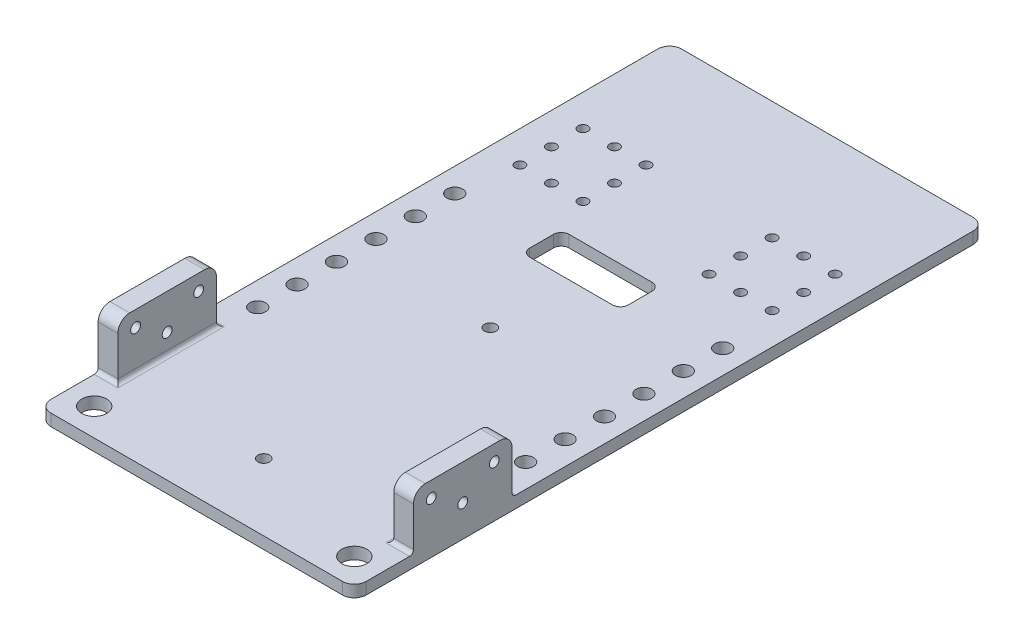
from build123d import *

# Parameters (mm, degrees)
SKETCH1_W           = 80
SKETCH1_H           = 160
SKETCH1_R           = 1.25
SKETCH1_R_2         = 1.5
SKETCH1_R_3         = 3.175
SKETCH1_W_2         = 25
SKETCH1_H_2         = 10
BOSS_EXTRUDE1_DEPTH = 3
SKETCH2_W           = 5
SKETCH2_H           = 25
BOSS_EXTRUDE2_DEPTH = 14
FILLET1_R           = 1
FILLET2_R           = 3
FILLET3_R           = 3
SKETCH4_R           = 1.25
CUT_EXTRUDE1_DEPTH  = 180.691402132
SKETCH6_R           = 2
CUT_EXTRUDE2_DEPTH  = 8.89
LPATTERN1_COUNT     = 6
LPATTERN1_PITCH     = 10
FILLET4_R           = 2


with BuildPart() as part:
    # Sketch1 → Boss-Extrude1 (new body)
    with BuildSketch(Plane(origin=(0, 0, 0), x_dir=(1, 0, 0), z_dir=(0, 1, 0))):
        with Locations((40, 80)):
            Rectangle(SKETCH1_W, SKETCH1_H)
        with Locations(Location((8, 130, 0), (0, 0, 270))):
            Circle(SKETCH1_R, mode=Mode.SUBTRACT)
        with Locations(Location((16, 130, 0), (0, 0, 270))):
            Circle(SKETCH1_R, mode=Mode.SUBTRACT)
        with Locations(Location((24, 130, 0), (0, 0, 270))):
            Circle(SKETCH1_R, mode=Mode.SUBTRACT)
        with Locations(Location((24, 122, 0), (0, 0, 270))):
            Circle(SKETCH1_R, mode=Mode.SUBTRACT)
        with Locations(Location((24, 114, 0), (0, 0, 270))):
            Circle(SKETCH1_R, mode=Mode.SUBTRACT)
        with Locations(Location((16, 114, 0), (0, 0, 270))):
            Circle(SKETCH1_R, mode=Mode.SUBTRACT)
        with Locations(Location((8, 114, 0), (0, 0, 270))):
            Circle(SKETCH1_R, mode=Mode.SUBTRACT)
        with Locations(Location((8, 122, 0), (0, 0, 270))):
            Circle(SKETCH1_R, mode=Mode.SUBTRACT)
        with Locations(Location((72, 130, 0), (0, 0, 90))):
            Circle(SKETCH1_R, mode=Mode.SUBTRACT)
        with Locations(Location((72, 122, 0), (0, 0, 90))):
            Circle(SKETCH1_R, mode=Mode.SUBTRACT)
        with Locations(Location((72, 114, 0), (0, 0, 90))):
            Circle(SKETCH1_R, mode=Mode.SUBTRACT)
        with Locations(Location((64, 114, 0), (0, 0, 90))):
            Circle(SKETCH1_R, mode=Mode.SUBTRACT)
        with Locations(Location((64, 130, 0), (0, 0, 90))):
            Circle(SKETCH1_R, mode=Mode.SUBTRACT)
        with Locations(Location((56, 130, 0), (0, 0, 90))):
            Circle(SKETCH1_R, mode=Mode.SUBTRACT)
        with Locations(Location((56, 122, 0), (0, 0, 90))):
            Circle(SKETCH1_R, mode=Mode.SUBTRACT)
        with Locations(Location((56, 114, 0), (0, 0, 90))):
            Circle(SKETCH1_R, mode=Mode.SUBTRACT)
        with Locations(Location((40, 17, 0), (0, 0, 270))):
            Circle(SKETCH1_R_2, mode=Mode.SUBTRACT)
        with Locations(Location((40, 74.5, 0), (0, 0, 270))):
            Circle(SKETCH1_R_2, mode=Mode.SUBTRACT)
        with Locations(Location((7, 7, 0), (0, 0, 270))):
            Circle(SKETCH1_R_3, mode=Mode.SUBTRACT)
        with Locations(Location((73, 7, 0), (0, 0, 90))):
            Circle(SKETCH1_R_3, mode=Mode.SUBTRACT)
        with Locations((40, 100)):
            Rectangle(SKETCH1_W_2, SKETCH1_H_2, mode=Mode.SUBTRACT)
    extrude(amount=BOSS_EXTRUDE1_DEPTH)

    # Sketch2 → Boss-Extrude2 (add)
    with BuildSketch(Plane(origin=(0, 3, 0), x_dir=(1, 0, 0), z_dir=(0, 1, 0))):
        with Locations((2.5, 27.5)):
            Rectangle(SKETCH2_W, SKETCH2_H)
        with Locations((77.5, 27.5)):
            Rectangle(SKETCH2_W, SKETCH2_H)
    extrude(amount=BOSS_EXTRUDE2_DEPTH)

    # Fillet1
    fillet1_edges = [part.edges().sort_by_distance(p)[0] for p in [
        (77.5, 3, -15),
        (75, 3, -27.5),
        (77.5, 3, -40),
        (2.5, 3, -40),
        (5, 3, -27.5),
        (2.5, 3, -15),
    ]]
    fillet(fillet1_edges, radius=FILLET1_R)

    # Fillet2
    fillet2_edges = [part.edges().sort_by_distance(p)[0] for p in [
        (0, 1.5, -160),
        (80, 1.5, -160),
        (80, 1.5, 0),
        (0, 1.5, 0),
    ]]
    fillet(fillet2_edges, radius=FILLET2_R)

    # Fillet3
    fillet3_edges = [part.edges().sort_by_distance(p)[0] for p in [
        (77.5, 17, -40),
        (77.5, 17, -15),
        (2.5, 17, -15),
        (2.5, 17, -40),
    ]]
    fillet(fillet3_edges, radius=FILLET3_R)

    # Sketch4 → Cut-Extrude1 (cut, through all)
    with BuildSketch(Plane.ZY):
        with Locations((-27.5, 8)):
            Circle(SKETCH4_R)
        with Locations((-35.5, 13)):
            Circle(SKETCH4_R)
        with Locations(Location((-19.5, 13, 0), (0, 0, 180))):
            Circle(SKETCH4_R)
    extrude(amount=-CUT_EXTRUDE1_DEPTH, mode=Mode.SUBTRACT)

    # Sketch6 → Cut-Extrude2 (cut)
    with BuildSketch(Plane(origin=(0, 3, 0), x_dir=(1, 0, 0), z_dir=(0, 1, 0))):
        with Locations(Location((6, 99.467444438, 0), (0, 0, 270))):
            Circle(SKETCH6_R)
        with Locations(Location((74, 99.467444438, 0), (0, 0, 270))):
            Circle(SKETCH6_R)
    cut_extrude2 = extrude(amount=-CUT_EXTRUDE2_DEPTH, mode=Mode.SUBTRACT)

    # LPattern1: Cut-Extrude2 ×6
    with Locations(*[(0, 0, i * LPATTERN1_PITCH) for i in range(1, LPATTERN1_COUNT)]):
        add(cut_extrude2, mode=Mode.SUBTRACT)

    # Fillet4
    fillet4_edges = [part.edges().sort_by_distance(p)[0] for p in [
        (52.5, 1.5, -95),
        (52.5, 1.5, -105),
        (27.5, 1.5, -105),
        (27.5, 1.5, -95),
    ]]
    fillet(fillet4_edges, radius=FILLET4_R)


solid = part.part
